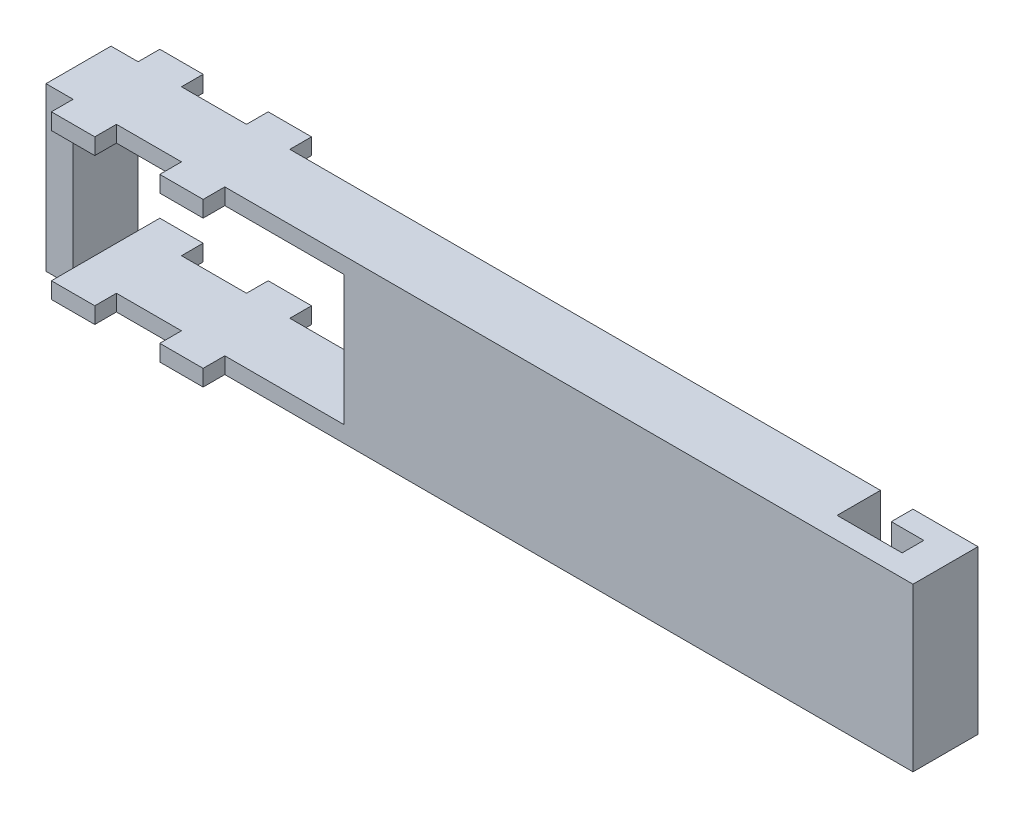
from build123d import *

# Parameters (mm, degrees)
SKETCH1_W           = 80
SKETCH1_H           = 15
BOSS_EXTRUDE1_DEPTH = 6
CUT_EXTRUDE1_DEPTH  = 82.614949611
SKETCH3_W           = 25
SKETCH3_H           = 12
CUT_EXTRUDE2_DEPTH  = 82.614949611
SKETCH4_W           = 4
SKETCH4_H           = 1.5
BOSS_EXTRUDE2_DEPTH = 2
SKETCH5_W           = 4
SKETCH5_H           = 1.5
BOSS_EXTRUDE3_DEPTH = 2
SKETCH6_W           = 4
SKETCH6_H           = 1.5
BOSS_EXTRUDE4_DEPTH = 2
SKETCH7_W           = 4
SKETCH7_H           = 1.5
BOSS_EXTRUDE5_DEPTH = 2
SKETCH9_W           = 4
SKETCH9_H           = 1.5
BOSS_EXTRUDE6_DEPTH = 2
SKETCH10_W          = 4
SKETCH10_H          = 1.5
BOSS_EXTRUDE7_DEPTH = 2
SKETCH12_W          = 4
SKETCH12_H          = 1.5
BOSS_EXTRUDE8_DEPTH = 2
SKETCH12_3_W        = 4
SKETCH12_3_H        = 1.5
BOSS_EXTRUDE9_DEPTH = 2


with BuildPart() as part:
    # Sketch1 → Boss-Extrude1 (new body)
    with BuildSketch(Plane.XY):
        with Locations((40, 7.5)):
            Rectangle(SKETCH1_W, SKETCH1_H)
    extrude(amount=BOSS_EXTRUDE1_DEPTH)

    # Sketch2 → Cut-Extrude1 (cut, through all)
    with BuildSketch(Plane(origin=(0, 15, 0), x_dir=(1, 0, 0), z_dir=(0, 1, 0))):
        Polygon((74, 0), (74, -2), (77, -2), (77, -4), (71, -4), (71, 0), align=None)
    extrude(amount=-CUT_EXTRUDE1_DEPTH, mode=Mode.SUBTRACT)

    # Sketch3 → Cut-Extrude2 (cut, through all)
    with BuildSketch(Plane.XY.offset(6)):
        with Locations((15, 7.5)):
            Rectangle(SKETCH3_W, SKETCH3_H)
    extrude(amount=-CUT_EXTRUDE2_DEPTH, mode=Mode.SUBTRACT)

    # Sketch4 → Boss-Extrude2 (add)
    with BuildSketch(Plane.XY.offset(6)):
        with Locations((4.5, 14.25)):
            Rectangle(SKETCH4_W, SKETCH4_H)
    extrude(amount=BOSS_EXTRUDE2_DEPTH)

    # Sketch5 → Boss-Extrude3 (add)
    with BuildSketch(Plane.XY.offset(6)):
        with Locations((14.5, 14.25)):
            Rectangle(SKETCH5_W, SKETCH5_H)
    extrude(amount=BOSS_EXTRUDE3_DEPTH)

    # Sketch6 → Boss-Extrude4 (add)
    with BuildSketch(Plane.XY.offset(6)):
        with Locations((4.5, 0.75)):
            Rectangle(SKETCH6_W, SKETCH6_H)
    extrude(amount=BOSS_EXTRUDE4_DEPTH)

    # Sketch7 → Boss-Extrude5 (add)
    with BuildSketch(Plane.XY.offset(6)):
        with Locations((14.5, 0.75)):
            Rectangle(SKETCH7_W, SKETCH7_H)
    extrude(amount=BOSS_EXTRUDE5_DEPTH)

    # Sketch9 → Boss-Extrude6 (add)
    with BuildSketch(Plane(origin=(0, 0, 0), x_dir=(-1, 0, 0), z_dir=(0, 0, -1))):
        with Locations((-4.5, 14.25)):
            Rectangle(SKETCH9_W, SKETCH9_H)
    extrude(amount=BOSS_EXTRUDE6_DEPTH)

    # Sketch10 → Boss-Extrude7 (add)
    with BuildSketch(Plane(origin=(0, 0, 0), x_dir=(-1, 0, 0), z_dir=(0, 0, -1))):
        with Locations((-14.5, 14.25)):
            Rectangle(SKETCH10_W, SKETCH10_H)
    extrude(amount=BOSS_EXTRUDE7_DEPTH)

    # Sketch12 → Boss-Extrude8 (add)
    with BuildSketch(Plane(origin=(0, 0, 0), x_dir=(-1, 0, 0), z_dir=(0, 0, -1))):
        with Locations((-14.5, 0.75)):
            Rectangle(SKETCH12_W, SKETCH12_H)
    extrude(amount=BOSS_EXTRUDE8_DEPTH)

    # Sketch12<3> → Boss-Extrude9 (add)
    with BuildSketch(Plane(origin=(0, 0, 0), x_dir=(-1, 0, 0), z_dir=(0, 0, -1))):
        with Locations((-4.5, 0.75)):
            Rectangle(SKETCH12_3_W, SKETCH12_3_H)
        with Locations((-14.5, 0.75)):
            Rectangle(SKETCH12_3_W, SKETCH12_3_H)
    extrude(amount=BOSS_EXTRUDE9_DEPTH)


solid = part.part
